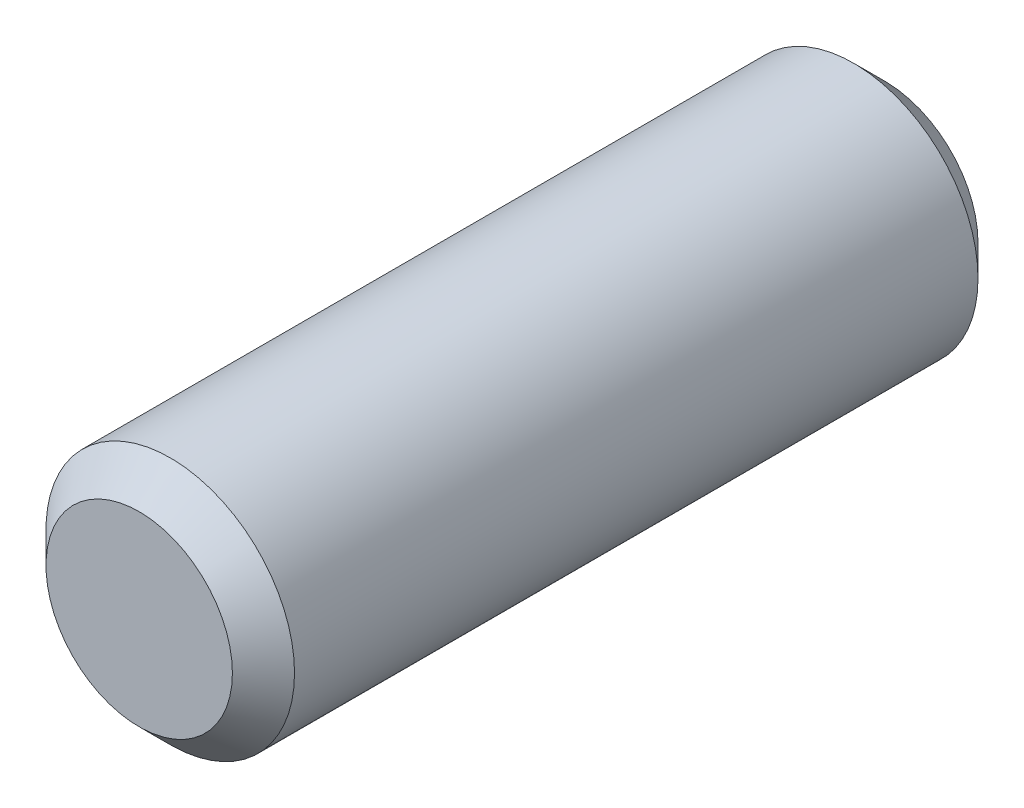
from build123d import *

# Parameters (mm, degrees)
SKETCH1_R           = 1
BOSS_EXTRUDE1_DEPTH = 3
CHAMFER1_SIZE       = 0.25


with BuildPart() as part:
    # Sketch1 → Boss-Extrude1 (new, symmetric)
    with BuildSketch(Plane.XY):
        Circle(SKETCH1_R)
    extrude(amount=BOSS_EXTRUDE1_DEPTH, both=True)

    # Chamfer1
    chamfer1_edges = [part.edges().sort_by_distance(p)[0] for p in [
        (-1, 0, -3),
        (-1, 0, 3),
    ]]
    chamfer(chamfer1_edges, length=CHAMFER1_SIZE)


solid = part.part
